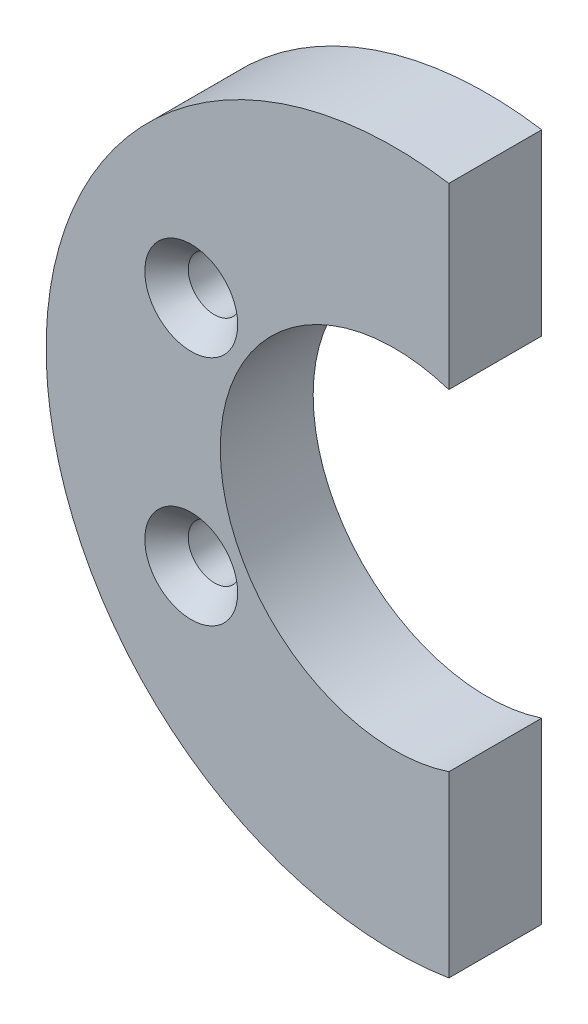
from build123d import *

# Parameters (mm, degrees)
BOSS_EXTRUDE1_DEPTH                                = 5.08
CSK_FOR_10_FLAT_HEAD_MACHINE_SCREW_100_D           = 2.8702
CSK_FOR_10_FLAT_HEAD_MACHINE_SCREW_100_CSINK_D     = 5.08
CSK_FOR_10_FLAT_HEAD_MACHINE_SCREW_100_CSINK_ANGLE = 82


with BuildPart() as part:
    # Sketch2 → Boss-Extrude1 (new body)
    with BuildSketch(Plane.XY):
        with BuildLine():
            Line((2.973598589, 18.816487755), (2.973598589, 9.048941177))
            ThreePointArc((2.973598589, 9.048941177), (-9.525, 0), (2.973598589, -9.048941177))
            Line((2.973598589, -9.048941177), (2.973598589, -18.816487755))
            ThreePointArc((2.973598589, -18.816487755), (-19.05, 0), (2.973598589, 18.816487755))
        make_face()
    extrude(amount=BOSS_EXTRUDE1_DEPTH)

    # CSK for #10 Flat Head Machine Screw (100)1 (through all)
    with Locations(Plane(origin=(-11.1125, 6.35, 5.08), x_dir=(1, 0, 0), z_dir=(0, 0, 1))):
        with Locations((0, 0), (0, -12.7)):
            CounterSinkHole(CSK_FOR_10_FLAT_HEAD_MACHINE_SCREW_100_D / 2, CSK_FOR_10_FLAT_HEAD_MACHINE_SCREW_100_CSINK_D / 2, counter_sink_angle=CSK_FOR_10_FLAT_HEAD_MACHINE_SCREW_100_CSINK_ANGLE)


solid = part.part
